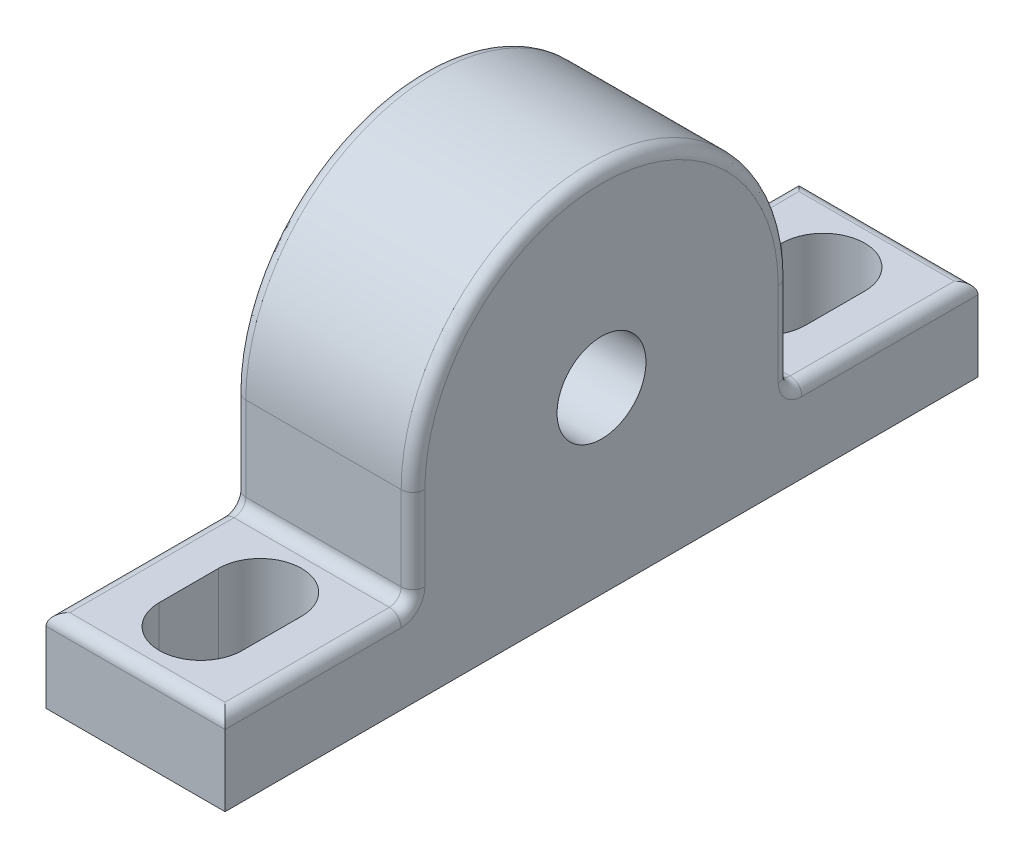
from build123d import *

# Parameters (mm, degrees)
DODANIE_WYCI_GNI_CIE1_DEPTH = 30.2
SZKIC2_R                    = 7.5
WYTNIJ_WYCI_GNI_CIE1_DEPTH  = 94.745879909
ZAOKR_GLENIE1_R             = 2
WYTNIJ_WYCI_GNI_CIE2_REACH  = 87.137


with BuildPart() as part:
    # Szkic1 → Dodanie-wyciągnięcie1 (new body)
    with BuildSketch(Plane(origin=(0, 0, 0), x_dir=(0, 0, -1), z_dir=(1, 0, 0))):
        with BuildLine():
            Line((31.8, 14), (63.5, 14))
            Line((63.5, 14), (63.5, 0))
            Line((63.5, 0), (-63.5, 0))
            Line((-63.5, 0), (-63.5, 14))
            Line((-63.5, 14), (-31.8, 14))
            Line((-31.8, 14), (-31.8, 30.2))
            ThreePointArc((-31.8, 30.2), (0, 62), (31.8, 30.2))
            Line((31.8, 30.2), (31.8, 14))
        make_face()
    extrude(amount=DODANIE_WYCI_GNI_CIE1_DEPTH)

    # Szkic2 → Wytnij-wyciągnięcie1 (cut, through all)
    with BuildSketch(Plane(origin=(30.2, 0, 0), x_dir=(0, 0, -1), z_dir=(1, 0, 0))):
        with Locations((0, 30.2)):
            Circle(SZKIC2_R)
    extrude(amount=-WYTNIJ_WYCI_GNI_CIE1_DEPTH, mode=Mode.SUBTRACT)

    # Zaokrąglenie1
    zaokr_glenie1_edges = [part.edges().sort_by_distance(p)[0] for p in [
        (0, 14, -47.65),
        (15.1, 14, 63.5),
        (15.1, 14, 31.8),
        (15.1, 14, -31.8),
        (15.1, 14, -63.5),
        (30.2, 14, -47.65),
        (30.2, 22.1, -31.8),
        (30.2, 62, 0),
        (30.2, 22.1, 31.8),
        (30.2, 14, 47.65),
        (0, 14, 47.65),
        (0, 22.1, 31.8),
        (0, 62, 0),
        (0, 22.1, -31.8),
    ]]
    fillet(zaokr_glenie1_edges, radius=ZAOKR_GLENIE1_R)

    # Szkic3 → Wytnij-wyciągnięcie2 (cut, up to next)
    with BuildSketch(Plane(origin=(0, 14, 0), x_dir=(1, 0, 0), z_dir=(0, 1, 0)), mode=Mode.PRIVATE) as wytnij_wyci_gni_cie2_sk1:
        with BuildLine():
            Line((8.1, -52.5), (8.1, -42.5))
            ThreePointArc((8.1, -42.5), (15.1, -35.5), (22.1, -42.5))
            Line((22.1, -42.5), (22.1, -52.5))
            ThreePointArc((22.1, -52.5), (15.1, -59.5), (8.1, -52.5))
        make_face()
    wytnij_wyci_gni_cie2_tool1 = extrude(wytnij_wyci_gni_cie2_sk1.sketch, amount=-WYTNIJ_WYCI_GNI_CIE2_REACH, mode=Mode.PRIVATE) & part.part
    # Szkic3 → Wytnij-wyciągnięcie2 (cut, up to next)
    with BuildSketch(Plane(origin=(0, 14, 0), x_dir=(1, 0, 0), z_dir=(0, 1, 0)), mode=Mode.PRIVATE) as wytnij_wyci_gni_cie2_sk2:
        with BuildLine():
            Line((8.1, 42.5), (8.1, 52.5))
            ThreePointArc((8.1, 52.5), (15.1, 59.5), (22.1, 52.5))
            Line((22.1, 52.5), (22.1, 42.5))
            ThreePointArc((22.1, 42.5), (15.1, 35.5), (8.1, 42.5))
        make_face()
    wytnij_wyci_gni_cie2_tool2 = extrude(wytnij_wyci_gni_cie2_sk2.sketch, amount=-WYTNIJ_WYCI_GNI_CIE2_REACH, mode=Mode.PRIVATE) & part.part
    add(wytnij_wyci_gni_cie2_tool1.solids().sort_by_distance((15.1, 14, 47.5))[0], mode=Mode.SUBTRACT)
    add(wytnij_wyci_gni_cie2_tool2.solids().sort_by_distance((15.1, 14, -47.5))[0], mode=Mode.SUBTRACT)


solid = part.part
